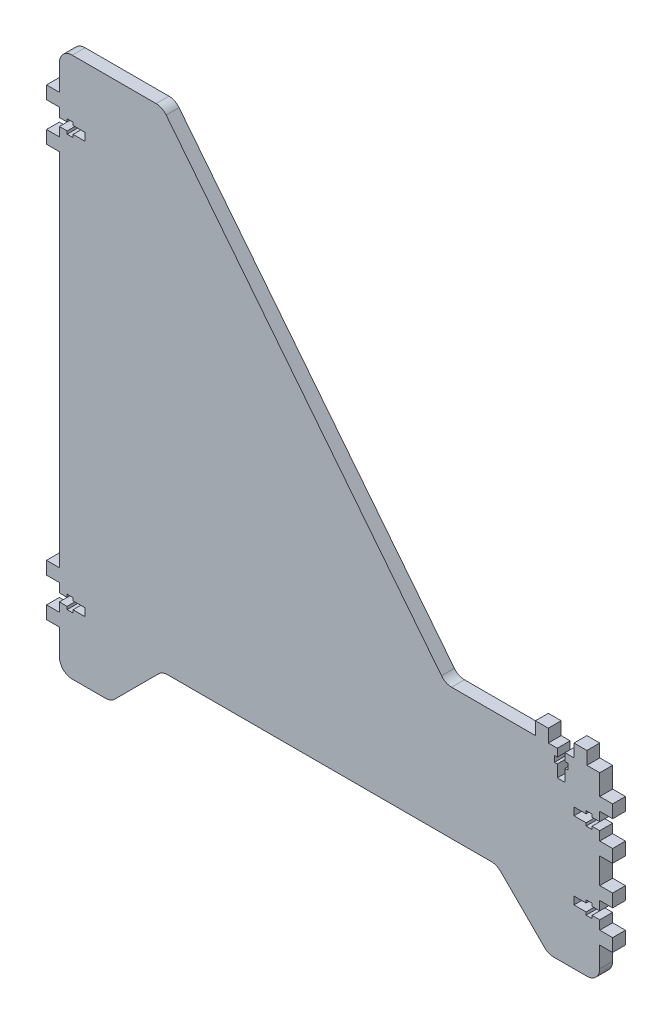
from build123d import *

# Parameters (mm, degrees)
BOSS_EXTRU_1_DEPTH = 5
CONG_1_R           = 5


with BuildPart() as part:
    # Esquisse1 → Boss.-Extru.1 (new body)
    with BuildSketch(Plane.XY):
        Polygon((0, 0), (20, 0), (20, 13), (25, 13), (25, 18), (20, 18), (20, 21.5), (17, 21.5), (17, 20.4), (14.7, 20.4), (14.7, 21.5), (10, 21.5), (10, 24.5), (14.7, 24.5), (14.7, 25.6), (17, 25.6), (17, 24.5), (20, 24.5), (20, 28), (25, 28), (25, 33), (20, 33), (20, 43), (25, 43), (25, 48), (20, 48), (20, 51.5), (17, 51.5), (17, 50.4), (14.7, 50.4), (14.7, 51.5), (10, 51.5), (10, 54.5), (14.7, 54.5), (14.7, 55.6), (17, 55.6), (17, 54.5), (20, 54.5), (20, 58), (25, 58), (25, 63), (20, 63), (20, 71), (15, 71), (15, 76), (10, 76), (10, 71), (6.5, 71), (6.5, 68), (7.6, 68), (7.6, 65.7), (6.5, 65.7), (6.5, 61), (3.5, 61), (3.5, 65.7), (2.4, 65.7), (2.4, 68), (3.5, 68), (3.5, 71), (0, 71), (0, 76), (-5, 76), (-5, 71), (-40, 71), (-150, 210), (-190, 210), (-190, 195), (-195, 195), (-195, 190), (-190, 190), (-190, 186.5), (-187, 186.5), (-187, 187.6), (-184.7, 187.6), (-184.7, 186.5), (-180, 186.5), (-180, 183.5), (-184.7, 183.5), (-184.7, 182.4), (-187, 182.4), (-187, 183.5), (-190, 183.5), (-190, 180), (-195, 180), (-195, 175), (-190, 175), (-190, 35), (-195, 35), (-195, 30), (-190, 30), (-190, 26.5), (-187, 26.5), (-187, 27.6), (-184.7, 27.6), (-184.7, 26.5), (-180, 26.5), (-180, 23.5), (-184.7, 23.5), (-184.7, 22.4), (-187, 22.4), (-187, 23.5), (-190, 23.5), (-190, 20), (-195, 20), (-195, 15), (-190, 15), (-190, 0), (-170, 0), (-150, 20), (-20, 20), align=None)
    extrude(amount=BOSS_EXTRU_1_DEPTH)

    # Congé1
    cong_1_edges = [part.edges().sort_by_distance(p)[0] for p in [
        (20, 0, 2.5),
        (0, 0, 2.5),
        (-20, 20, 2.5),
        (-150, 20, 2.5),
        (-170, 0, 2.5),
        (-190, 0, 2.5),
        (-190, 210, 2.5),
        (-150, 210, 2.5),
        (-40, 71, 2.5),
    ]]
    fillet(cong_1_edges, radius=CONG_1_R)


solid = part.part
